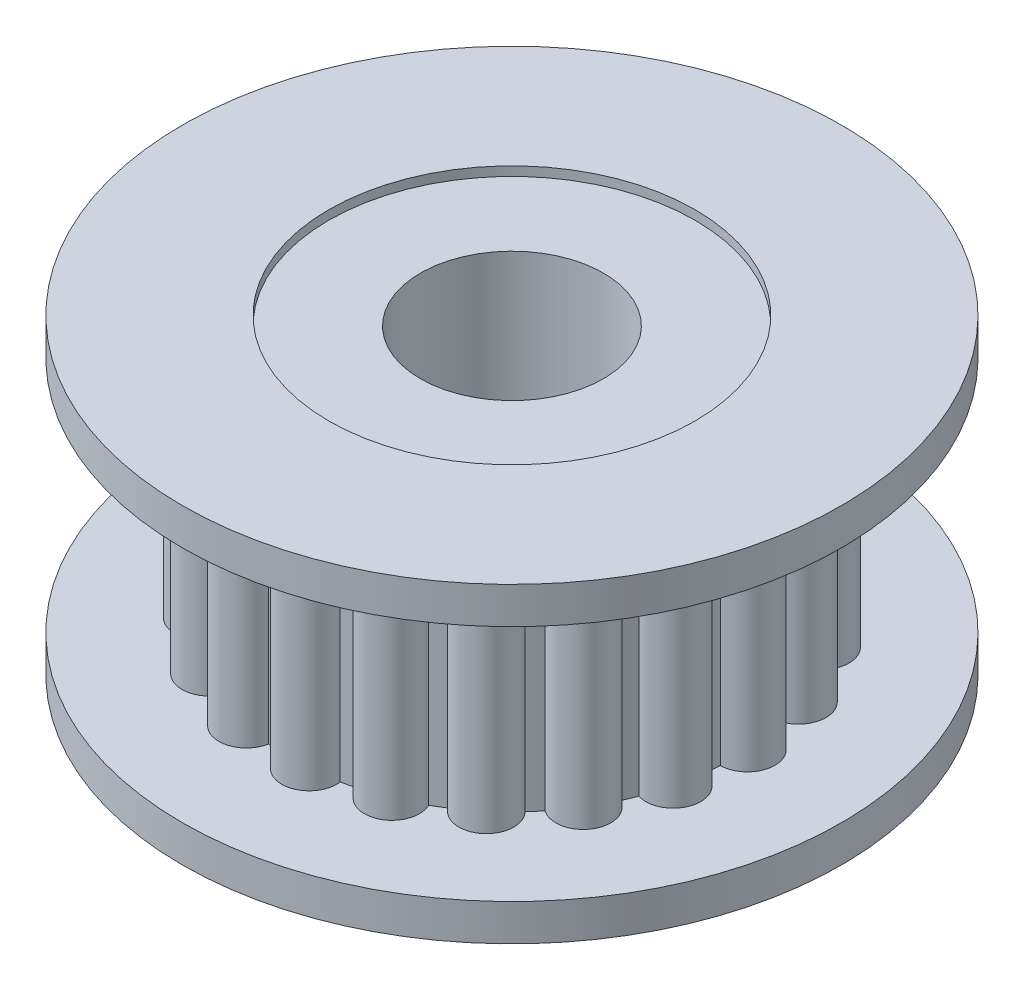
from build123d import *

# Parameters (mm, degrees)
SKETCH_2_R               = 0.75
EXTRUDE_1_DEPTH          = 7
PATTERN_CIRCULAR_1_COUNT = 20


with BuildPart() as part:
    # 草图1 → 旋转1 (revolve)
    with BuildSketch(Plane.XY, mode=Mode.PRIVATE) as revolve_1_sk:
        Polygon((-9, 4.25), (-5, 4.25), (-5, 4), (-2.5, 4), (-2.5, -4), (-5, -4), (-5, -4.25), (-9, -4.25), (-9, -3.25), (-6, -3.25), (-6, 3.25), (-9, 3.25), align=None)
    revolve(revolve_1_sk.sketch.rotate(Axis((0, 36.523336922, 0), (0, -1, 0)), 270), axis=Axis((0, 36.523336922, 0), (0, -1, 0)))

    # 草图2 → 凸台-拉伸1 (add)
    with BuildSketch(Plane(origin=(0, -3.25, 0), x_dir=(1, 0, 0), z_dir=(0, 1, 0))):
        with Locations((3.878999087, -4.577484689)):
            Circle(SKETCH_2_R)
    extrude_1 = extrude(amount=EXTRUDE_1_DEPTH)

    # 阵列(圆周)1: 凸台-拉伸1 ×20 about axis
    pattern_circular_1_axis = Axis((0, 0, 0), (0, 1, 0))
    for i in range(1, PATTERN_CIRCULAR_1_COUNT):
        add(extrude_1.rotate(pattern_circular_1_axis, i * 360 / PATTERN_CIRCULAR_1_COUNT))


solid = part.part
